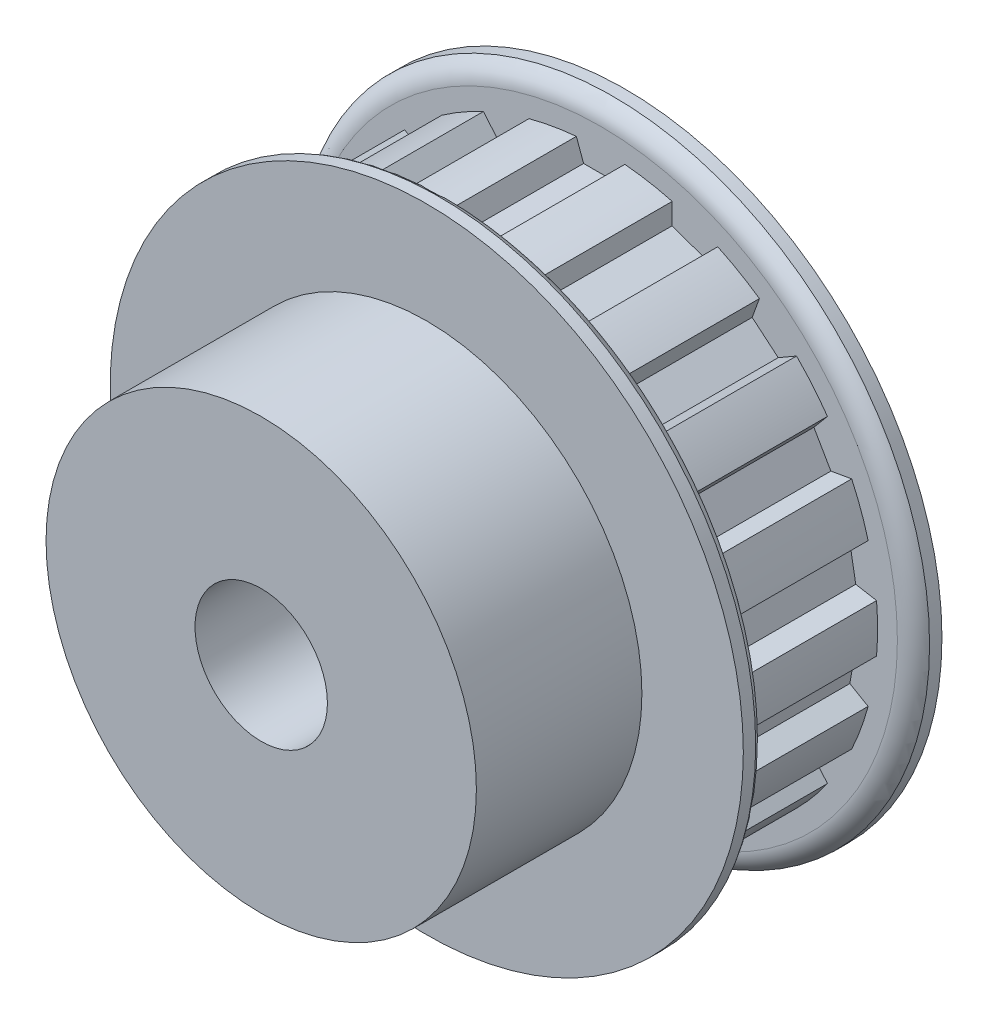
from build123d import *

# Parameters (mm, degrees)
CUT_EXTRUDE1_START = -0.7874
CUT_EXTRUDE1_DEPTH = 14.3002
CIRPATTERN1_COUNT  = 18


with BuildPart() as part:
    # Sketch2 → Revolve1 (revolve)
    with BuildSketch(Plane(origin=(0, 0, 0), x_dir=(0, 0, -1), z_dir=(1, 0, 0)), mode=Mode.PRIVATE) as revolve1_sk:
        with BuildLine():
            Line((-17.4625, 6.35), (17.4625, 6.35))
            Line((17.4625, 6.35), (17.4625, 30.3657))
            Line((17.4625, 30.3657), (16.27505, 30.3657))
            ThreePointArc((16.27505, 30.3657), (15.408910445, 29.58682048), (15.0876, 28.467172932))
            Line((15.0876, 28.467172932), (15.0876, 26.568645864))
            Line((15.0876, 26.568645864), (0.7874, 26.568645864))
            Line((0.7874, 26.568645864), (0.7874, 28.467172932))
            ThreePointArc((0.7874, 28.467172932), (0.466089555, 29.58682048), (-0.40005, 30.3657))
            Line((-0.40005, 30.3657), (-1.5875, 30.3657))
            Line((-1.5875, 30.3657), (-1.5875, 20.6375))
            Line((-1.5875, 20.6375), (-17.4625, 20.6375))
            Line((-17.4625, 20.6375), (-17.4625, 6.35))
        make_face()
    revolve(revolve1_sk.sketch.rotate(Axis((0, 0, 17.4625), (0, 0, -1)), 90), axis=Axis((0, 0, 17.4625), (0, 0, -1)))

    # Sketch3 → Cut-Extrude1 (cut)
    with BuildSketch(Plane.XY.offset(CUT_EXTRUDE1_START)):
        with BuildLine():
            Line((-1.630736704, 24.5618), (1.630736704, 24.5618))
            Line((1.630736704, 24.5618), (2.3241, 26.4668))
            ThreePointArc((2.3241, 26.4668), (0, 26.568645864), (-2.3241, 26.4668))
            Line((-2.3241, 26.4668), (-1.630736704, 24.5618))
        make_face()
    cut_extrude1 = extrude(amount=-CUT_EXTRUDE1_DEPTH, mode=Mode.SUBTRACT)

    # CirPattern1: Cut-Extrude1 ×18 about axis
    cirpattern1_axis = Axis((0, 0, 0), (0, 0, 1))
    for i in range(1, CIRPATTERN1_COUNT):
        add(cut_extrude1.rotate(cirpattern1_axis, i * 360 / CIRPATTERN1_COUNT), mode=Mode.SUBTRACT)


solid = part.part
